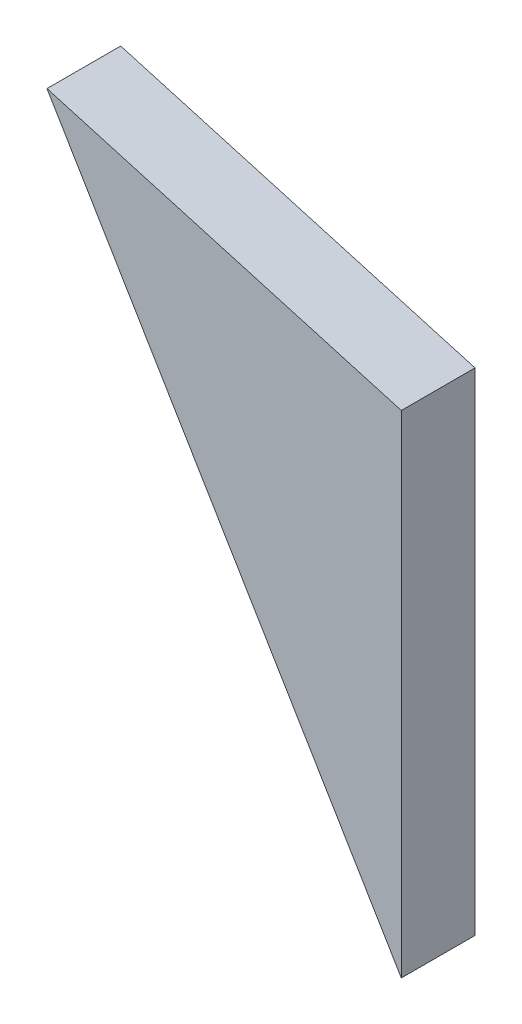
from build123d import *

# Parameters (mm, degrees)
BOSS_EXTRUDE1_DEPTH = 3


with BuildPart() as part:
    # Sketch1 → Boss-Extrude1 (new body)
    with BuildSketch(Plane.XY):
        Polygon((0, 0), (0, -20), (-14.418925439, 4.134560337), align=None)
    extrude(amount=BOSS_EXTRUDE1_DEPTH)


solid = part.part
